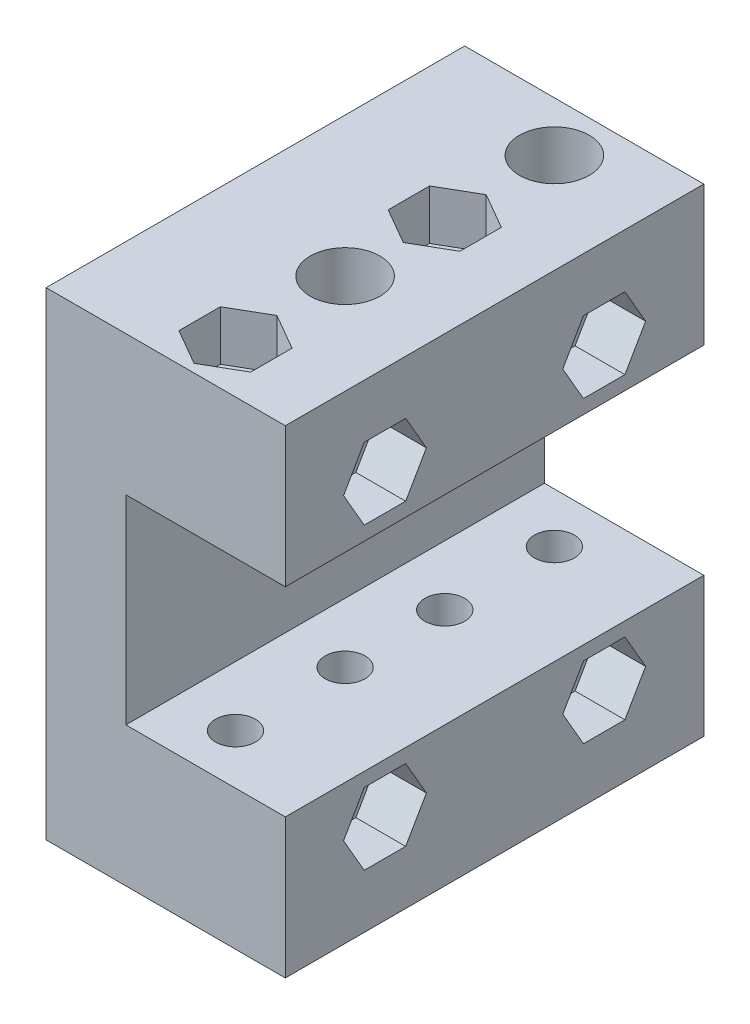
from build123d import *

# Parameters (mm, degrees)
EXTRUDE_1_DEPTH     = 42
SKETCH_2_R          = 2
CUT_EXTRUDE_1_DEPTH = 65.899922958
SKETCH_3_R          = 2.25
CUT_EXTRUDE_2_DEPTH = 55
CUT_EXTRUDE_3_DEPTH = 5
SKETCH_5_R          = 3.5
CUT_EXTRUDE_4_DEPTH = 5
SKETCH_6_R          = 3.5
CUT_EXTRUDE_5_DEPTH = 5


with BuildPart() as part:
    # 草圖1 → 填料-伸長1 (new body)
    with BuildSketch(Plane.XY):
        Polygon((12, 10), (-4, 10), (-4, -10), (12, -10), (12, -24), (-12, -24), (-12, 24), (12, 24), align=None)
    extrude(amount=EXTRUDE_1_DEPTH)

    # 草圖2 → 除料-伸長1 (cut, through all)
    with BuildSketch(Plane(origin=(0, 24, 0), x_dir=(1, 0, 0), z_dir=(0, 1, 0))):
        with Locations((2, -5)):
            Circle(SKETCH_2_R)
        with Locations((2, -16)):
            Circle(SKETCH_2_R)
        with Locations((2, -26)):
            Circle(SKETCH_2_R)
        with Locations((2, -37)):
            Circle(SKETCH_2_R)
    extrude(amount=-CUT_EXTRUDE_1_DEPTH, mode=Mode.SUBTRACT)

    # 草圖3 → 除料-伸長2 (cut, through all)
    with BuildSketch(Plane.ZY.offset(12)):
        with Locations((10, 15)):
            Circle(SKETCH_3_R)
        with Locations((32, 15)):
            Circle(SKETCH_3_R)
        with Locations((32, -15)):
            Circle(SKETCH_3_R)
        with Locations((10, -15)):
            Circle(SKETCH_3_R)
    extrude(amount=-CUT_EXTRUDE_2_DEPTH, mode=Mode.SUBTRACT)

    # 草圖4 → 除料-伸長3 (cut)
    with BuildSketch(Plane(origin=(12, 0, 0), x_dir=(0, 0, -1), z_dir=(1, 0, 0))):
        Polygon((-5.843078062, 15), (-7.921539031, 18.6), (-12.078460969, 18.6), (-14.156921938, 15), (-12.078460969, 11.4), (-7.921539031, 11.4), align=None)
        Polygon((-27.843078062, 15), (-29.921539031, 18.6), (-34.078460969, 18.6), (-36.156921938, 15), (-34.078460969, 11.4), (-29.921539031, 11.4), align=None)
        Polygon((-27.843078062, -15), (-29.921539031, -11.4), (-34.078460969, -11.4), (-36.156921938, -15), (-34.078460969, -18.6), (-29.921539031, -18.6), align=None)
        Polygon((-5.843078062, -15), (-7.921539031, -11.4), (-12.078460969, -11.4), (-14.156921938, -15), (-12.078460969, -18.6), (-7.921539031, -18.6), align=None)
    extrude(amount=-CUT_EXTRUDE_3_DEPTH, mode=Mode.SUBTRACT)

    # 草圖5 → 除料-伸長4 (cut)
    with BuildSketch(Plane.XZ.offset(24)):
        with Locations((2, 16)):
            Circle(SKETCH_5_R)
        with Locations((2, 37)):
            Circle(SKETCH_5_R)
        Polygon((2, 21.843078062), (5.6, 23.921539031), (5.6, 28.078460969), (2, 30.156921938), (-1.6, 28.078460969), (-1.6, 23.921539031), align=None)
        Polygon((6.156921938, 5), (4.078460969, 8.6), (-0.078460969, 8.6), (-2.156921938, 5), (-0.078460969, 1.4), (4.078460969, 1.4), align=None)
    extrude(amount=-CUT_EXTRUDE_4_DEPTH, mode=Mode.SUBTRACT)

    # 草圖6 → 除料-伸長5 (cut)
    with BuildSketch(Plane(origin=(0, 24, 0), x_dir=(1, 0, 0), z_dir=(0, 1, 0))):
        with Locations((2, -26)):
            Circle(SKETCH_6_R)
        with Locations((2, -5)):
            Circle(SKETCH_6_R)
        Polygon((2, -11.843078062), (-1.6, -13.921539031), (-1.6, -18.078460969), (2, -20.156921938), (5.6, -18.078460969), (5.6, -13.921539031), align=None)
        Polygon((2, -32.843078062), (-1.6, -34.921539031), (-1.6, -39.078460969), (2, -41.156921938), (5.6, -39.078460969), (5.6, -34.921539031), align=None)
    extrude(amount=-CUT_EXTRUDE_5_DEPTH, mode=Mode.SUBTRACT)


solid = part.part
